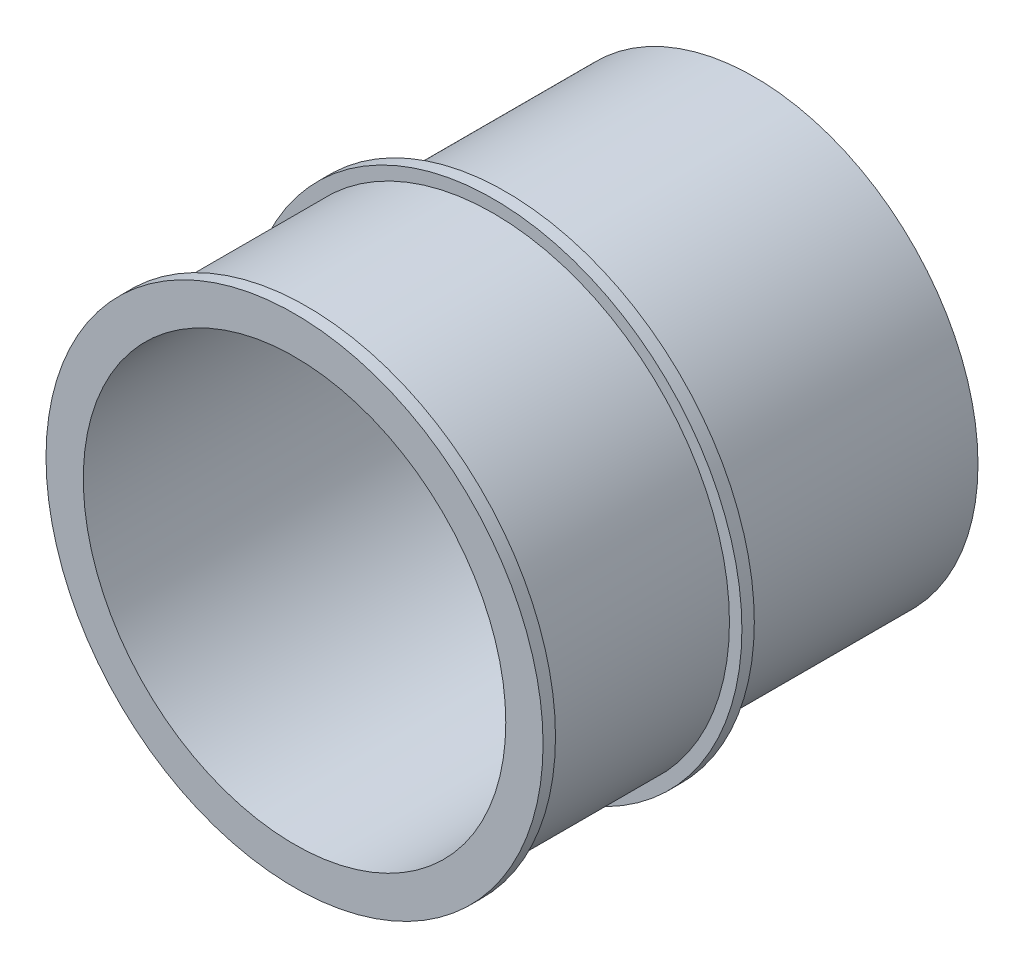
from build123d import *

# Parameters (mm, degrees)
SKETCH_1_R               = 38
SKETCH_1_R_2             = 36
EXTRUDE_1_DEPTH          = 34
EXTRUDE_START            = -2
SKETCH_2_R               = 40
SKETCH_2_R_2             = 38
EXTRUDE_2_DEPTH          = 2
EXTRUDE_START_2          = -34
SKETCH_2_2_R             = 40
SKETCH_2_2_R_2           = 38
EXTRUDE_3_DEPTH          = 2
SKETCH_3_R               = 36
SKETCH_3_R_2             = 34
EXTRUDE_4_DEPTH          = 40
SKETCH_4_R               = 34
EXTRUDE_5_DEPTH          = 2
CUT_EXTRUDE_1_DEPTH      = 94.145048178
CUT_EXTRUDE_1_DEPTH_BACK = 94.145048178
SKETCH_5_R               = 5
EXTRUDE_START_3          = -30
SKETCH_6_R               = 34
EXTRUDE_6_DEPTH          = 2
EXTRUDE_7_DEPTH          = 10
SKETCH_8_R               = 36
SKETCH_8_R_2             = 34
EXTRUDE_9_DEPTH          = 34


with BuildPart() as part:
    # 草图1 → 凸台-拉伸1 (new body)
    with BuildSketch(Plane.XY):
        Circle(SKETCH_1_R)
        Circle(SKETCH_1_R_2, mode=Mode.SUBTRACT)
    extrude(amount=EXTRUDE_1_DEPTH)

    # 草图2 → 凸台-拉伸2 (add)
    with BuildSketch(Plane.XY.offset(34).offset(EXTRUDE_START)):
        Circle(SKETCH_2_R)
        Circle(SKETCH_2_R_2, mode=Mode.SUBTRACT)
    extrude(amount=EXTRUDE_2_DEPTH)

    # 草图2<2> → 凸台-拉伸3 (add)
    with BuildSketch(Plane.XY.offset(34).offset(EXTRUDE_START_2)):
        Circle(SKETCH_2_2_R)
        Circle(SKETCH_2_2_R_2, mode=Mode.SUBTRACT)
    extrude(amount=EXTRUDE_3_DEPTH)



with BuildPart() as body_2:
    # 草图3 → 凸台-拉伸4 (new body)
    with BuildSketch(Plane(origin=(0, 0, 0), x_dir=(-1, 0, 0), z_dir=(0, 0, -1))):
        with Locations(Location((0, 0, 0), (0, 0, 180))):
            Circle(SKETCH_3_R)
        Circle(SKETCH_3_R_2, mode=Mode.SUBTRACT)
    extrude(amount=EXTRUDE_4_DEPTH)

    # 草图4 → 凸台-拉伸5 (add)
    with BuildSketch(Plane(origin=(0, 0, -40), x_dir=(-1, 0, 0), z_dir=(0, 0, -1))):
        Circle(SKETCH_4_R)
    extrude(amount=-EXTRUDE_5_DEPTH)

    # 草图5 → 切除-拉伸1 (cut, two sides: drawn at the far end of the back side and taken through both)
    with BuildSketch(Plane(origin=(0, 0, -40), x_dir=(-1, 0, 0), z_dir=(0, 0, -1)).offset(-CUT_EXTRUDE_1_DEPTH_BACK)):
        Circle(SKETCH_5_R)
    extrude(amount=CUT_EXTRUDE_1_DEPTH + CUT_EXTRUDE_1_DEPTH_BACK, mode=Mode.SUBTRACT)

    # 草图6 → 凸台-拉伸6 (add)
    with BuildSketch(Plane.XY.offset(EXTRUDE_START_3)):
        Circle(SKETCH_6_R)
    extrude(amount=EXTRUDE_6_DEPTH)

    # 草图7 → 凸台-拉伸7 (add)
    with BuildSketch(Plane.XY.offset(-28)):
        Polygon((0, 7), (12, 7), (12, -7), (-12, -7), (-12, 7), align=None)
        Polygon((0, 5), (10, 5), (10, -5), (-10, -5), (-10, 5), align=None, mode=Mode.SUBTRACT)
    extrude(amount=EXTRUDE_7_DEPTH)


with BuildPart() as part_1:
    add(part.part)

    add(body_2.part)  # 凸台-拉伸9 merges body 2
    # 草图8 → 凸台-拉伸9 (add, through all)
    with BuildSketch(Plane.XY):
        Circle(SKETCH_8_R)
        Circle(SKETCH_8_R_2, mode=Mode.SUBTRACT)
    extrude(amount=EXTRUDE_9_DEPTH)


solid = part_1.part
